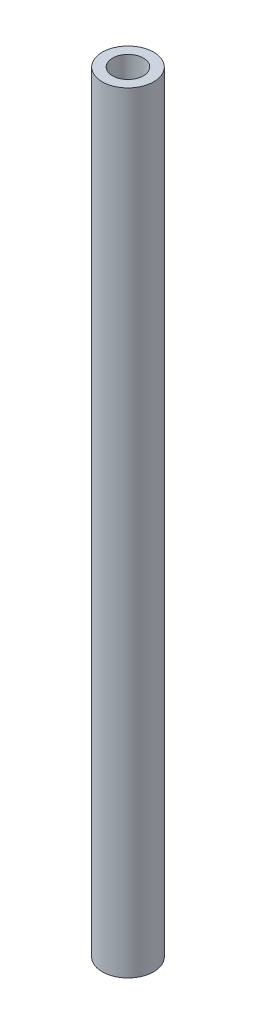
from build123d import *

# Parameters (mm, degrees)
SKETCH1_R           = 2.5
SKETCH1_R_2         = 1.5
BOSS_EXTRUDE1_DEPTH = 75


with BuildPart() as part:
    # Sketch1 → Boss-Extrude1 (new body)
    with BuildSketch(Plane(origin=(0, 0, 0), x_dir=(1, 0, 0), z_dir=(0, 1, 0))):
        with Locations(Location((0, 0, 0), (0, 0, 270))):
            Circle(SKETCH1_R)
        with Locations(Location((0, 0, 0), (0, 0, 270))):
            Circle(SKETCH1_R_2, mode=Mode.SUBTRACT)
    extrude(amount=BOSS_EXTRUDE1_DEPTH)


solid = part.part
